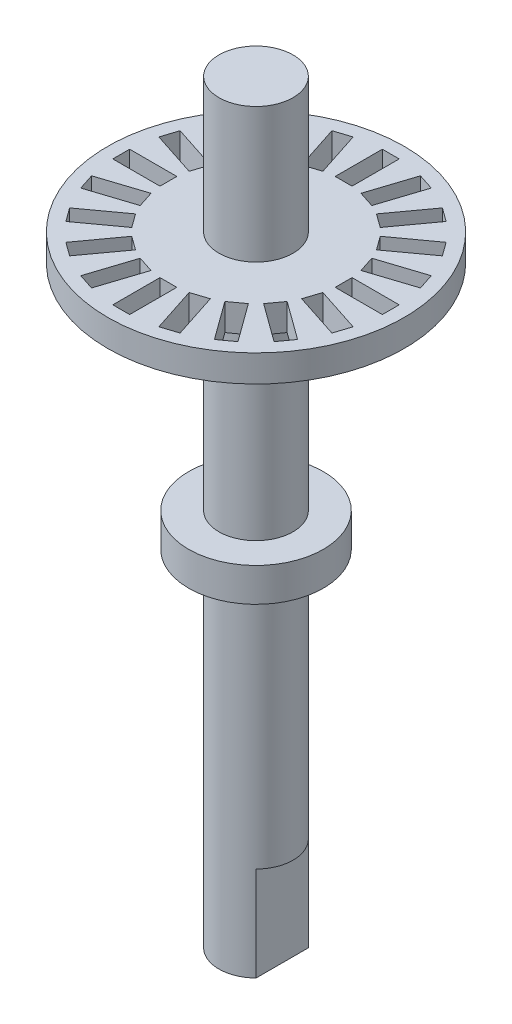
from build123d import *
from build123d.topology import SkipClean

# Parameters (mm, degrees)
SKETCH_1_R      = 2.75
EXTRUDE_1_DEPTH = 49
EXTRUDE_START   = 7
EXTRUDE_2_DEPTH = 7
EXTRUDE_START_2 = -12
SKETCH_6_R      = 11
SKETCH_6_W      = 1.25
SKETCH_6_H      = 3.5
SKETCH_6_W_2    = 3.5
SKETCH_6_H_2    = 1.25
EXTRUDE_4_DEPTH = 2
EXTRUDE_START_3 = -27.9
SKETCH_7_R      = 5
EXTRUDE_5_DEPTH = 2.5


with BuildPart() as part:
    # 草图1 → 凸台-拉伸1 (new body)
    with BuildSketch(Plane(origin=(0, 0, 0), x_dir=(1, 0, 0), z_dir=(0, 1, 0))):
        Circle(SKETCH_1_R)
    extrude(amount=EXTRUDE_1_DEPTH)

    # 草图2 → 凸台-拉伸2 (add)
    with SkipClean():  # the faces are left unmerged after this step: merging them gives an invalid solid
        with BuildSketch(Plane.XZ.offset(EXTRUDE_START)):
            with BuildLine():
                Line((-1.95, 1.939071943), (-1.95, -1.939071943))
                ThreePointArc((-1.95, -1.939071943), (0, -2.75), (1.95, -1.939071943))
                Line((1.95, -1.939071943), (1.95, 1.939071943))
                ThreePointArc((1.95, 1.939071943), (0, 2.75), (-1.95, 1.939071943))
            make_face()
        extrude(amount=-EXTRUDE_2_DEPTH)

    # 草图6 → 凸台-拉伸4 (add)
    with SkipClean():  # the faces are left unmerged after this step: merging them gives an invalid solid
        with BuildSketch(Plane(origin=(0, 49, 0), x_dir=(1, 0, 0), z_dir=(0, 1, 0)).offset(EXTRUDE_START_2)):
            Circle(SKETCH_6_R)
            Polygon((2.495759621, 9.703700784), (3.684580266, 9.317429541), (2.603020786, 5.988731734), (1.414200141, 6.375002977), align=None, mode=Mode.SUBTRACT)
            with Locations((0, 8.25)):
                Rectangle(SKETCH_6_W, SKETCH_6_H, mode=Mode.SUBTRACT)
            Polygon((5.372216901, 8.457535726), (6.383488144, 7.722804161), (4.326239761, 4.891244681), (3.314968518, 5.625976246), align=None, mode=Mode.SUBTRACT)
            Polygon((7.722804161, 6.383488144), (8.457535726, 5.372216901), (5.625976246, 3.314968518), (4.891244681, 4.326239761), align=None, mode=Mode.SUBTRACT)
            Polygon((9.317429541, 3.684580266), (9.703700784, 2.495759621), (6.375002977, 1.414200141), (5.988731734, 2.603020786), align=None, mode=Mode.SUBTRACT)
            with Locations((8.25, 0)):
                Rectangle(SKETCH_6_W_2, SKETCH_6_H_2, mode=Mode.SUBTRACT)
            Polygon((9.703700784, -2.495759621), (9.317429541, -3.684580266), (5.988731734, -2.603020786), (6.375002977, -1.414200141), align=None, mode=Mode.SUBTRACT)
            Polygon((8.457535726, -5.372216901), (7.722804161, -6.383488144), (4.891244681, -4.326239761), (5.625976246, -3.314968518), align=None, mode=Mode.SUBTRACT)
            Polygon((6.383488144, -7.722804161), (5.372216901, -8.457535726), (3.314968518, -5.625976246), (4.326239761, -4.891244681), align=None, mode=Mode.SUBTRACT)
            Polygon((3.684580266, -9.317429541), (2.495759621, -9.703700784), (1.414200141, -6.375002977), (2.603020786, -5.988731734), align=None, mode=Mode.SUBTRACT)
            with Locations((0, -8.25)):
                Rectangle(SKETCH_6_W, SKETCH_6_H, mode=Mode.SUBTRACT)
            Polygon((-2.495759621, -9.703700784), (-3.684580266, -9.317429541), (-2.603020786, -5.988731734), (-1.414200141, -6.375002977), align=None, mode=Mode.SUBTRACT)
            Polygon((-5.372216901, -8.457535726), (-6.383488144, -7.722804161), (-4.326239761, -4.891244681), (-3.314968518, -5.625976246), align=None, mode=Mode.SUBTRACT)
            Polygon((-7.722804161, -6.383488144), (-8.457535726, -5.372216901), (-5.625976246, -3.314968518), (-4.891244681, -4.326239761), align=None, mode=Mode.SUBTRACT)
            Polygon((-9.317429541, -3.684580266), (-9.703700784, -2.495759621), (-6.375002977, -1.414200141), (-5.988731734, -2.603020786), align=None, mode=Mode.SUBTRACT)
            with Locations((-8.25, 0)):
                Rectangle(SKETCH_6_W_2, SKETCH_6_H_2, mode=Mode.SUBTRACT)
            Polygon((-9.703700784, 2.495759621), (-9.317429541, 3.684580266), (-5.988731734, 2.603020786), (-6.375002977, 1.414200141), align=None, mode=Mode.SUBTRACT)
            Polygon((-8.457535726, 5.372216901), (-7.722804161, 6.383488144), (-4.891244681, 4.326239761), (-5.625976246, 3.314968518), align=None, mode=Mode.SUBTRACT)
            Polygon((-6.383488144, 7.722804161), (-5.372216901, 8.457535726), (-3.314968518, 5.625976246), (-4.326239761, 4.891244681), align=None, mode=Mode.SUBTRACT)
            Polygon((-3.684580266, 9.317429541), (-2.495759621, 9.703700784), (-1.414200141, 6.375002977), (-2.603020786, 5.988731734), align=None, mode=Mode.SUBTRACT)
        extrude(amount=EXTRUDE_4_DEPTH)

    # 草图7 → 凸台-拉伸5 (add)
    with SkipClean():  # the faces are left unmerged after this step: merging them gives an invalid solid
        with BuildSketch(Plane(origin=(0, 49, 0), x_dir=(1, 0, 0), z_dir=(0, 1, 0)).offset(EXTRUDE_START_3)):
            Circle(SKETCH_7_R)
        extrude(amount=-EXTRUDE_5_DEPTH)


solid = part.part
